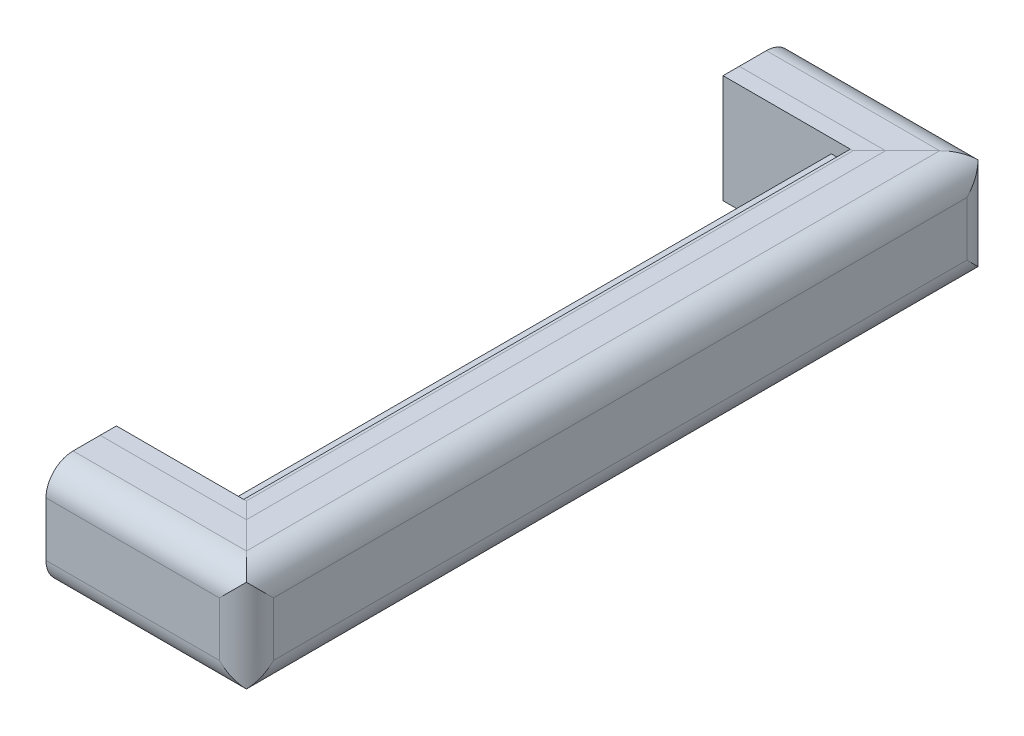
from build123d import *

# Parameters (mm, degrees)
CUT_EXTRUDE1_DEPTH      = 502.207716421
CUT_EXTRUDE1_DEPTH_BACK = 502.207716421
SKETCH4_W               = 22.225
SKETCH4_H               = 3.175
BOSS_EXTRUDE1_DEPTH     = 711.2


with BuildPart() as part:
    # Sweep1: sweep along a path in Sketch2
    with BuildLine(Plane(origin=(0, 0, 0), x_dir=(1, 0, 0), z_dir=(0, 1, 0))) as sweep1_path:
        Line((0, -355.6), (152.4, -355.6))
        Line((152.4, -355.6), (152.4, 355.6))
        Line((152.4, 355.6), (0, 355.6))
    # Sketch1 → Sweep1 (sweep)
    with BuildSketch(Plane(origin=(0, 0, 0), x_dir=(0, 0, -1), z_dir=(1, 0, 0))):
        with BuildLine():
            Line((-374.65, 63.5), (-355.6, 63.5))
            Line((-355.6, 63.5), (-355.6, -63.5))
            Line((-355.6, -63.5), (-374.65, -63.5))
            Line((-374.65, -63.5), (-406.4, -63.5))
            ThreePointArc((-406.4, -63.5), (-428.850640303, -54.200640303), (-438.15, -31.75))
            Line((-438.15, -31.75), (-438.15, 31.75))
            ThreePointArc((-438.15, 31.75), (-428.850640303, 54.200640303), (-406.4, 63.5))
            Line((-406.4, 63.5), (-374.65, 63.5))
        make_face()
    sweep(path=sweep1_path.line, transition=Transition.RIGHT)

    # Sketch3 → Cut-Extrude1 (cut, two sides: drawn at the far end of the back side and taken through both)
    with BuildSketch(Plane(origin=(0, 0, 0), x_dir=(1, 0, 0), z_dir=(0, 1, 0)).offset(-CUT_EXTRUDE1_DEPTH_BACK)):
        with BuildLine():
            ThreePointArc((234.95, -406.4), (225.650640303, -428.850640303), (203.2, -438.15))
            Line((203.2, -438.15), (234.95, -438.15))
            Line((234.95, -438.15), (234.95, -406.4))
        make_face()
        with BuildLine():
            ThreePointArc((203.2, 438.15), (225.650640303, 428.850640303), (234.95, 406.4))
            Line((234.95, 406.4), (234.95, 438.15))
            Line((234.95, 438.15), (203.2, 438.15))
        make_face()
    extrude(amount=CUT_EXTRUDE1_DEPTH + CUT_EXTRUDE1_DEPTH_BACK, mode=Mode.SUBTRACT)


with BuildPart() as body_2:
    # Sketch4 → Boss-Extrude1 (new body)
    with BuildSketch(Plane(origin=(0, 0, 355.6), x_dir=(-1, 0, 0), z_dir=(0, 0, -1))):
        Polygon((-149.225, 63.5), (-152.4, 63.5), (-152.4, 44.45), (-149.225, 44.45), (-149.225, 47.625), align=None)
        with Locations((-138.1125, 46.0375)):
            Rectangle(SKETCH4_W, SKETCH4_H)
    extrude(amount=BOSS_EXTRUDE1_DEPTH)


solid = Compound([part.part, body_2.part])
